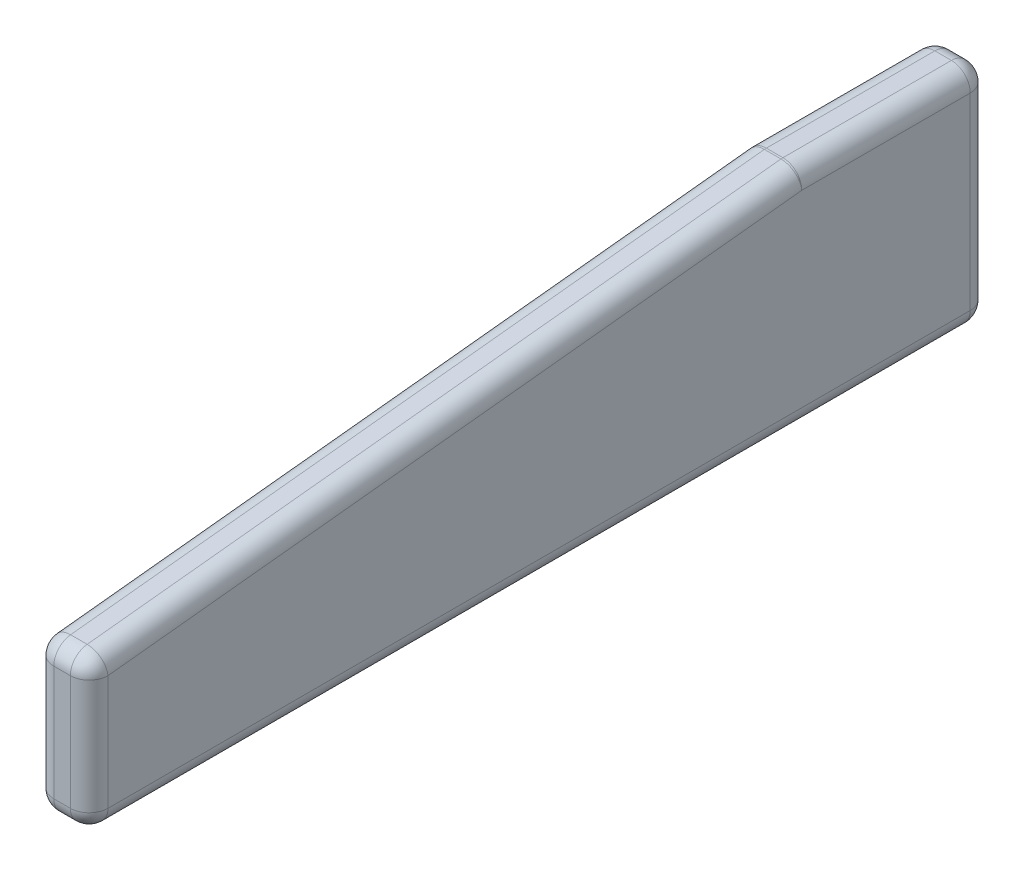
from build123d import *

# Parameters (mm, degrees)
BOSS_EXTRUDE1_DEPTH                 = 18.288
FILLET1_R                           = 6.35
F_3_32_0_09375_DIAMETER_HOLE2_D     = 2.38125
F_3_32_0_09375_DIAMETER_HOLE2_DEPTH = 10.0000054
F_3_32_0_09375_DIAMETER_HOLE2_TIP   = 0.715399675
F_3_32_0_09375_DIAMETER_HOLE3_D     = 2.38125
F_3_32_0_09375_DIAMETER_HOLE3_DEPTH = 9.906
F_3_32_0_09375_DIAMETER_HOLE3_TIP   = 0.715399675
F_3_32_0_09375_DIAMETER_HOLE4_D     = 2.38125
F_3_32_0_09375_DIAMETER_HOLE4_DEPTH = 9.906
F_3_32_0_09375_DIAMETER_HOLE4_TIP   = 0.715399675
F_3_32_0_09375_DIAMETER_HOLE5_D     = 2.38125
F_3_32_0_09375_DIAMETER_HOLE5_DEPTH = 10.0000054
F_3_32_0_09375_DIAMETER_HOLE5_TIP   = 0.715399675


with BuildPart() as part:
    # Sketch1 → Boss-Extrude1 (new body)
    with BuildSketch(Plane(origin=(0, 0, 0), x_dir=(0, 0, -1), z_dir=(1, 0, 0))):
        with BuildLine():
            Line((-166.973473818, -57.646230654), (123.785960254, -57.646230654))
            ThreePointArc((123.785960254, -57.646230654), (128.276088314, -55.786358715), (130.135960254, -51.296230654))
            Line((130.135960254, -51.296230654), (130.135960254, 12.203769346))
            ThreePointArc((130.135960254, 12.203769346), (128.276088314, 16.693897406), (123.785960254, 18.553769346))
            Line((123.785960254, 18.553769346), (66.971101736, 18.553769346))
            ThreePointArc((66.971101736, 18.553769346), (66.636426055, 18.5449437), (66.302680683, 18.518491295))
            Line((66.302680683, 18.518491295), (-167.641894871, -6.244828564))
            ThreePointArc((-167.641894871, -6.244828564), (-171.694012648, -8.31231457), (-173.323473818, -12.559550513))
            Line((-173.323473818, -12.559550513), (-173.323473818, -51.296230654))
            ThreePointArc((-173.323473818, -51.296230654), (-171.463601879, -55.786358715), (-166.973473818, -57.646230654))
        make_face()
    extrude(amount=BOSS_EXTRUDE1_DEPTH)

    # Fillet1
    fillet1_edges = [part.edges().sort_by_distance(p)[0] for p in [
        (18.288, -8.31231457, 171.694012648),
        (0, -19.546230654, -130.135960254),
        (0, -55.786358715, -128.276088314),
        (0, -57.646230654, 21.593756782),
        (0, -55.786358715, 171.463601879),
        (0, -31.927890584, 173.323473818),
        (0, -8.31231457, 171.694012648),
        (0, 6.136831366, 50.669607094),
        (0, 18.5449437, -66.636426055),
        (18.288, -31.927890584, 173.323473818),
        (18.288, -55.786358715, 171.463601879),
        (18.288, -57.646230654, 21.593756782),
        (18.288, -55.786358715, -128.276088314),
        (18.288, -19.546230654, -130.135960254),
        (18.288, 16.693897406, -128.276088314),
        (18.288, 18.553769346, -95.378530995),
        (18.288, 18.5449437, -66.636426055),
        (18.288, 6.136831366, 50.669607094),
        (0, 18.553769346, -95.378530995),
        (0, 16.693897406, -128.276088314),
    ]]
    fillet(fillet1_edges, radius=FILLET1_R)

    # 3/32 (0.09375) Diameter Hole2
    with Locations(Plane.ZY):
        with Locations((16.022312628, -10.951018239), (85.63342073, -18.319439291)):
            Hole(F_3_32_0_09375_DIAMETER_HOLE2_D / 2, depth=F_3_32_0_09375_DIAMETER_HOLE2_DEPTH)
            with Locations((0, 0, -(F_3_32_0_09375_DIAMETER_HOLE2_DEPTH + F_3_32_0_09375_DIAMETER_HOLE2_TIP / 2))):  # 118° drill point
                Cone(0, F_3_32_0_09375_DIAMETER_HOLE2_D / 2, F_3_32_0_09375_DIAMETER_HOLE2_TIP, mode=Mode.SUBTRACT)

    # 3/32 (0.09375) Diameter Hole3
    with Locations(Plane.ZY):
        with Locations((158.074809607, -26.796230654), (-114.925190393, -6.796230654)):
            Hole(F_3_32_0_09375_DIAMETER_HOLE3_D / 2, depth=F_3_32_0_09375_DIAMETER_HOLE3_DEPTH)
            with Locations((0, 0, -(F_3_32_0_09375_DIAMETER_HOLE3_DEPTH + F_3_32_0_09375_DIAMETER_HOLE3_TIP / 2))):  # 118° drill point
                Cone(0, F_3_32_0_09375_DIAMETER_HOLE3_D / 2, F_3_32_0_09375_DIAMETER_HOLE3_TIP, mode=Mode.SUBTRACT)

    # 3/32 (0.09375) Diameter Hole4
    with Locations(Plane.ZY):
        with Locations((-93.924468997, -45.296232872), (-18.924468997, -45.296232872), (62.074800328, -45.296232872), (137.074800328, -45.296232872)):
            Hole(F_3_32_0_09375_DIAMETER_HOLE4_D / 2, depth=F_3_32_0_09375_DIAMETER_HOLE4_DEPTH)
            with Locations((0, 0, -(F_3_32_0_09375_DIAMETER_HOLE4_DEPTH + F_3_32_0_09375_DIAMETER_HOLE4_TIP / 2))):  # 118° drill point
                Cone(0, F_3_32_0_09375_DIAMETER_HOLE4_D / 2, F_3_32_0_09375_DIAMETER_HOLE4_TIP, mode=Mode.SUBTRACT)

    # 3/32 (0.09375) Diameter Hole5
    with Locations(Plane.ZY):
        with Locations((-87.93134055, 7.163769346), (0.456111434, -0.001640397), (99.83035199, -10.520525474)):
            Hole(F_3_32_0_09375_DIAMETER_HOLE5_D / 2, depth=F_3_32_0_09375_DIAMETER_HOLE5_DEPTH)
            with Locations((0, 0, -(F_3_32_0_09375_DIAMETER_HOLE5_DEPTH + F_3_32_0_09375_DIAMETER_HOLE5_TIP / 2))):  # 118° drill point
                Cone(0, F_3_32_0_09375_DIAMETER_HOLE5_D / 2, F_3_32_0_09375_DIAMETER_HOLE5_TIP, mode=Mode.SUBTRACT)


solid = part.part
